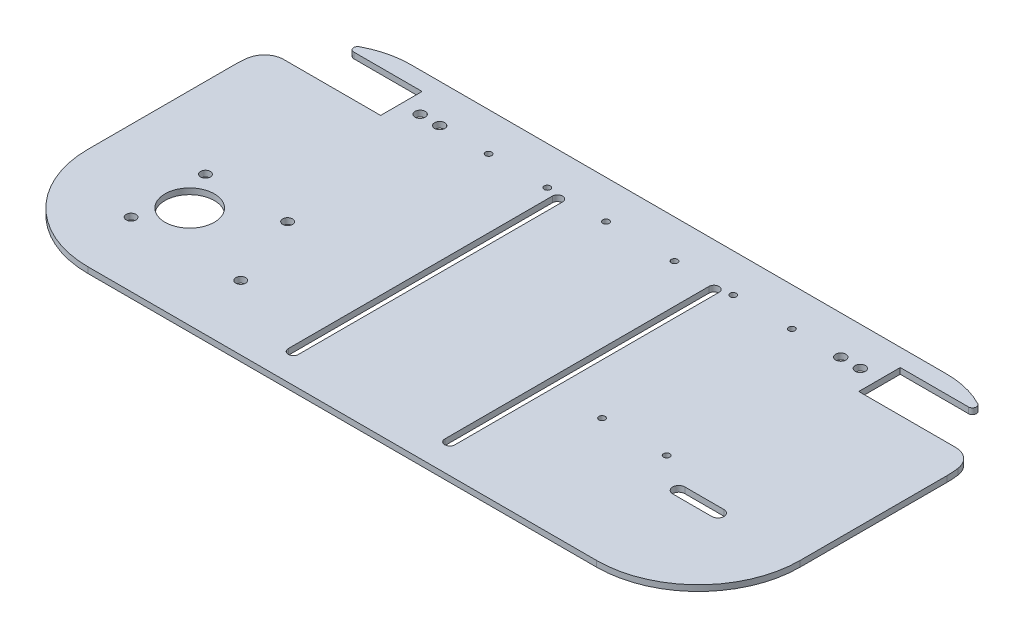
from build123d import *

# Parameters (mm, degrees)
SKETCH1_R           = 3.1
BOSS_EXTRUDE1_DEPTH = 3
CUT_EXTRUDE1_DEPTH  = 335.294780097
FILLET1_R           = 45
SKETCH3_R           = 12.6
CUT_EXTRUDE2_DEPTH  = 335.294780097
SKETCH5_W           = 0.2
SKETCH5_H           = 15.2
SKETCH5_W_2         = 15.2
CUT_EXTRUDE4_DEPTH  = 335.294780097
FILLET3_R           = 2
FILLET4_R           = 10
SKETCH4_R           = 2.5
CUT_EXTRUDE5_DEPTH  = 10
SKETCH7_R           = 2.6
SKETCH7_R_2         = 1.6
CUT_EXTRUDE6_DEPTH  = 335.294780097
SKETCH8_R           = 1.6
CUT_EXTRUDE7_DEPTH  = 335.294780097


with BuildPart() as part:
    # Sketch1 → Boss-Extrude1 (new body)
    # profile 1 of 2: a face of its own
    with BuildSketch(Plane(origin=(0, 0, 0), x_dir=(1, 0, 0), z_dir=(0, 1, 0))):
        with BuildLine():
            Line((0, -52), (260, -52))
            ThreePointArc((260, -52), (312, 0), (260, 52))
            Line((260, 52), (0, 52))
            ThreePointArc((0, 52), (-52, 0), (0, -52))
        make_face()
        with Locations(Location((0, 0, 0), (0, 0, 270))):
            Circle(SKETCH1_R, mode=Mode.SUBTRACT)
        with BuildLine():
            ThreePointArc((250, 3.1), (246.9, 0), (250, -3.1))
            Line((250, -3.1), (270, -3.1))
            ThreePointArc((270, -3.1), (273.1, 0), (270, 3.1))
            Line((270, 3.1), (250, 3.1))
        make_face(mode=Mode.SUBTRACT)
    # profile 2 of 2: a face of its own
    with BuildSketch(Plane(origin=(0, 0, 0), x_dir=(1, 0, 0), z_dir=(0, 1, 0))):
        with BuildLine():
            ThreePointArc((-52, 0), (-36.769552622, 36.769552622), (0, 52))
            Line((0, 52), (260, 52))
            ThreePointArc((260, 52), (296.769552622, 36.769552622), (312, 0))
            Line((312, 0), (312, 120))
            Line((312, 120), (-52, 120))
            Line((-52, 120), (-52, 0))
        make_face()
    extrude(amount=BOSS_EXTRUDE1_DEPTH)

    # Sketch2 → Cut-Extrude1 (cut, through all)
    with BuildSketch(Plane(origin=(0, 3, 0), x_dir=(1, 0, 0), z_dir=(0, 1, 0))):
        with BuildLine():
            Line((87.4, -37), (87.4, 98))
            ThreePointArc((87.4, 98), (90, 100.6), (92.6, 98))
            Line((92.6, 98), (92.6, -37))
            ThreePointArc((92.6, -37), (90, -39.6), (87.4, -37))
        make_face()
        with BuildLine():
            Line((172.6, -37), (172.6, 98))
            ThreePointArc((172.6, 98), (170, 100.6), (167.4, 98))
            Line((167.4, 98), (167.4, -37))
            ThreePointArc((167.4, -37), (170, -39.6), (172.6, -37))
        make_face()
    extrude(amount=-CUT_EXTRUDE1_DEPTH, mode=Mode.SUBTRACT)

    # Fillet1
    fillet1_edges = [part.edges().sort_by_distance(p)[0] for p in [
        (-52, 1.5, -120),
        (312, 1.5, -120),
    ]]
    fillet(fillet1_edges, radius=FILLET1_R)

    # Sketch3 → Cut-Extrude2 (cut, through all)
    with BuildSketch(Plane(origin=(0, 3, 0), x_dir=(1, 0, 0), z_dir=(0, 1, 0))):
        with Locations(Location((0, 0, 0), (0, 0, 270))):
            Circle(SKETCH3_R)
    extrude(amount=-CUT_EXTRUDE2_DEPTH, mode=Mode.SUBTRACT)

    # Sketch5 → Cut-Extrude4 (cut, through all)
    with BuildSketch(Plane(origin=(0, 3, 0), x_dir=(1, 0, 0), z_dir=(0, 1, 0))):
        with BuildLine():
            Line((-52, 108), (-37.594117082, 108))
            ThreePointArc((-37.594117082, 108), (-35.836098568, 109.546771476), (-34, 111))
            Line((-34, 111), (-52, 111))
            Line((-52, 111), (-52, 108))
        make_face()
        with BuildLine():
            Line((-7.6, 92.8), (-7.6, 108))
            Line((-7.6, 108), (-37.594117082, 108))
            ThreePointArc((-37.594117082, 108), (-43.756302622, 100.961013415), (-48.32989233, 92.8))
            Line((-48.32989233, 92.8), (-7.6, 92.8))
        make_face()
        with BuildLine():
            Line((7.6, 92.8), (-7.6, 92.8))
            Line((-7.6, 92.8), (-48.32989233, 92.8))
            ThreePointArc((-48.32989233, 92.8), (-48.940072785, 91.310435149), (-49.496588098, 89.8))
            Line((-49.496588098, 89.8), (7.8, 89.8))
            Line((7.8, 89.8), (7.8, 92.8))
            Line((7.8, 92.8), (7.6, 92.8))
        make_face()
        with Locations((7.7, 100.4)):
            Rectangle(SKETCH5_W, SKETCH5_H)
        with BuildLine():
            Line((-37.594117082, 108), (-7.6, 108))
            Line((-7.6, 108), (7.6, 108))
            Line((7.6, 108), (7.8, 108))
            Line((7.8, 108), (7.8, 111))
            Line((7.8, 111), (-34, 111))
            ThreePointArc((-34, 111), (-35.836098568, 109.546771476), (-37.594117082, 108))
        make_face()
        with Locations((0, 100.4)):
            Rectangle(SKETCH5_W_2, SKETCH5_H)
        with BuildLine():
            ThreePointArc((-48.32989233, 92.8), (-43.756302622, 100.961013415), (-37.594117082, 108))
            Line((-37.594117082, 108), (-52, 108))
            Line((-52, 108), (-52, 92.8))
            Line((-52, 92.8), (-48.32989233, 92.8))
        make_face()
        with BuildLine():
            ThreePointArc((-49.496588098, 89.8), (-48.940072785, 91.310435149), (-48.32989233, 92.8))
            Line((-48.32989233, 92.8), (-52, 92.8))
            Line((-52, 92.8), (-52, 89.8))
            Line((-52, 89.8), (-49.496588098, 89.8))
        make_face()
        with BuildLine():
            Line((252.2, 108), (252.4, 108))
            Line((252.4, 108), (267.6, 108))
            Line((267.6, 108), (297.594117082, 108))
            ThreePointArc((297.594117082, 108), (295.836098568, 109.546771476), (294, 111))
            Line((294, 111), (252.2, 111))
            Line((252.2, 111), (252.2, 108))
        make_face()
        with Locations((252.3, 100.4)):
            Rectangle(SKETCH5_W, SKETCH5_H)
        with Locations((260, 100.4)):
            Rectangle(SKETCH5_W_2, SKETCH5_H)
        with BuildLine():
            Line((267.6, 92.8), (252.4, 92.8))
            Line((252.4, 92.8), (252.2, 92.8))
            Line((252.2, 92.8), (252.2, 89.8))
            Line((252.2, 89.8), (309.496588098, 89.8))
            ThreePointArc((309.496588098, 89.8), (308.940072785, 91.310435149), (308.32989233, 92.8))
            Line((308.32989233, 92.8), (267.6, 92.8))
        make_face()
        with BuildLine():
            Line((297.594117082, 108), (267.6, 108))
            Line((267.6, 108), (267.6, 92.8))
            Line((267.6, 92.8), (308.32989233, 92.8))
            ThreePointArc((308.32989233, 92.8), (303.756302622, 100.961013415), (297.594117082, 108))
        make_face()
    extrude(amount=-CUT_EXTRUDE4_DEPTH, mode=Mode.SUBTRACT)

    # Fillet3
    fillet3_edges = [part.edges().sort_by_distance(p)[0] for p in [
        (294, 1.5, -111),
        (-34, 1.5, -111),
    ]]
    fillet(fillet3_edges, radius=FILLET3_R)

    # Fillet4
    fillet4_edges = [part.edges().sort_by_distance(p)[0] for p in [
        (309.496588098, 1.5, -89.8),
        (-49.496588098, 1.5, -89.8),
    ]]
    fillet(fillet4_edges, radius=FILLET4_R)

    # Sketch4 → Cut-Extrude5 (cut)
    with BuildSketch(Plane(origin=(0, 3, 0), x_dir=(1, 0, 0), z_dir=(0, 1, 0))):
        with Locations(Location((-10.938925726, 19, 0), (0, 0, 270))):
            Circle(SKETCH4_R)
        with Locations(Location((31.061074274, 19, 0), (0, 0, 270))):
            Circle(SKETCH4_R)
        with Locations(Location((45.07, -19, 0), (0, 0, 270))):
            Circle(SKETCH4_R)
        with Locations(Location((-10.938925726, -19, 0), (0, 0, 270))):
            Circle(SKETCH4_R)
    extrude(amount=-CUT_EXTRUDE5_DEPTH, mode=Mode.SUBTRACT)

    # Sketch7 → Cut-Extrude6 (cut, through all)
    with BuildSketch(Plane(origin=(0, 3, 0), x_dir=(1, 0, 0), z_dir=(0, 1, 0))):
        with Locations(Location((17.4, 100.4, 0), (0, 0, 270))):
            Circle(SKETCH7_R)
        with Locations(Location((27.4, 100.4, 0), (0, 0, 270))):
            Circle(SKETCH7_R)
        with Locations(Location((82.4, 100.4, 0), (0, 0, 270))):
            Circle(SKETCH7_R_2)
        with Locations(Location((112.4, 100.4, 0), (0, 0, 270))):
            Circle(SKETCH7_R_2)
        with Locations(Location((147.4, 100.4, 0), (0, 0, 270))):
            Circle(SKETCH7_R_2)
        with Locations(Location((177.4, 100.4, 0), (0, 0, 270))):
            Circle(SKETCH7_R_2)
        with Locations(Location((207.4, 100.4, 0), (0, 0, 270))):
            Circle(SKETCH7_R_2)
        with Locations(Location((232.4, 100.4, 0), (0, 0, 270))):
            Circle(SKETCH7_R)
        with Locations(Location((242.4, 100.4, 0), (0, 0, 270))):
            Circle(SKETCH7_R)
        with Locations(Location((52.4, 100.4, 0), (0, 0, 270))):
            Circle(SKETCH7_R_2)
    extrude(amount=-CUT_EXTRUDE6_DEPTH, mode=Mode.SUBTRACT)

    # Sketch8 → Cut-Extrude7 (cut, through all)
    with BuildSketch(Plane(origin=(0, 3, 0), x_dir=(1, 0, 0), z_dir=(0, 1, 0))):
        with Locations(Location((231.4, 12.4, 0), (0, 0, 270))):
            Circle(SKETCH8_R)
        with Locations(Location((198.4, 12.4, 0), (0, 0, 270))):
            Circle(SKETCH8_R)
    extrude(amount=-CUT_EXTRUDE7_DEPTH, mode=Mode.SUBTRACT)


solid = part.part
